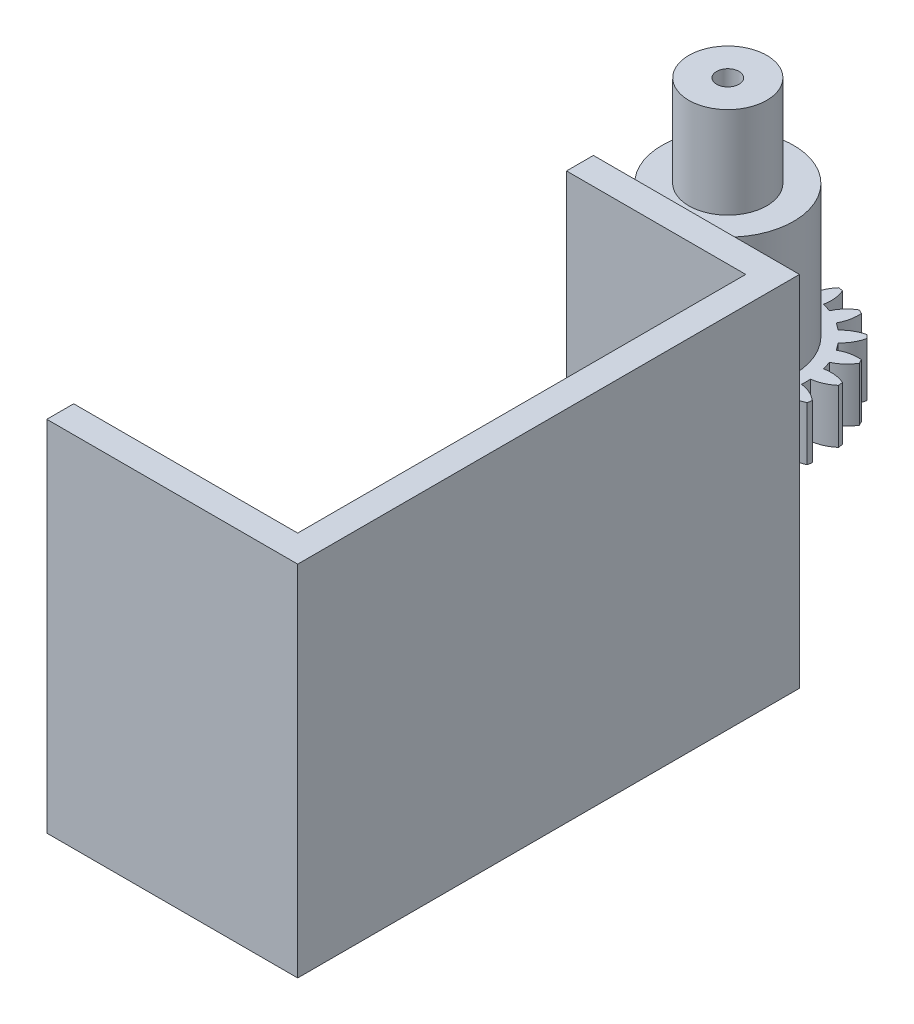
from build123d import *

# Parameters (mm, degrees)
EXTRUDE_1_DEPTH = 6
EXTRUDE_2_DEPTH = 20
SKETCH_3_W      = 25
SKETCH_3_H      = 50
EXTRUDE_3_DEPTH = 3
EXTRUDE_4_DEPTH = 6
SKETCH_5_R      = 7.35
EXTRUDE_5_DEPTH = 14.8
SKETCH_6_R      = 4.35
SKETCH_6_R_2    = 1.25
EXTRUDE_6_DEPTH = 10.2


with BuildPart() as part:
    # 草图1 → 凸台-拉伸1 (new body)
    with BuildSketch(Plane(origin=(0, 0, 0), x_dir=(1, 0, 0), z_dir=(0, 1, 0))):
        with BuildLine():
            Line((-5, 0), (-5, -13))
            Line((-5, -13), (15, -13))
            Line((15, -13), (15, -63))
            Line((15, -63), (-10, -63))
            Line((-10, -63), (-10, -66))
            Line((-10, -66), (18, -66))
            Line((18, -66), (18, -10))
            Line((18, -10), (5, -10))
            Line((5, -10), (5, 0))
            ThreePointArc((5, 0), (0, 5), (-5, 0))
        make_face()
    extrude(amount=-EXTRUDE_1_DEPTH)

    # 草图2 → 凸台-拉伸2 (add, symmetric)
    with BuildSketch(Plane(origin=(0, 0, 0), x_dir=(1, 0, 0), z_dir=(0, 1, 0))):
        Polygon((-5, -13), (15, -13), (15, -63), (-10, -63), (-10, -66), (18, -66), (18, -10), (-5, -10), align=None)
    extrude(amount=EXTRUDE_2_DEPTH, both=True)

    # 草图3 → 凸台-拉伸3 (add)
    with BuildSketch(Plane.XZ.offset(20)):
        with Locations((2.5, 38)):
            Rectangle(SKETCH_3_W, SKETCH_3_H)
    extrude(amount=-EXTRUDE_3_DEPTH)

    # 草图4 → 凸台-拉伸4 (add)
    with BuildSketch(Plane.XZ.offset(6)):
        with BuildLine():
            ThreePointArc((-0.504732798, 8.734428762), (-0.823506466, 9.891100464), (-1.470958285, 10.901205517))
            ThreePointArc((-1.470958285, 10.901205517), (-1.726760313, 10.86362273), (-1.981608382, 10.820038273))
            ThreePointArc((-1.981608382, 10.820038273), (-2.283953757, 9.65896405), (-2.228374617, 8.460457882))
            ThreePointArc((-2.228374617, 8.460457882), (-2.708170263, 8.319303747), (-3.17911634, 8.150964378))
            ThreePointArc((-3.17911634, 8.150964378), (-3.839719327, 9.152518056), (-4.767622226, 9.913111434))
            ThreePointArc((-4.767622226, 9.913111434), (-4.999290692, 9.798320906), (-5.228197271, 9.678117239))
            ThreePointArc((-5.228197271, 9.678117239), (-5.156953143, 8.480440175), (-4.733735466, 7.357767973))
            ThreePointArc((-4.733735466, 7.357767973), (-5.146429214, 7.075257405), (-5.542305825, 6.76962681))
            ThreePointArc((-5.542305825, 6.76962681), (-6.480073708, 7.518023412), (-7.597598086, 7.954652936))
            ThreePointArc((-7.597598086, 7.954652936), (-7.782455665, 7.773891163), (-7.963013783, 7.588834659))
            ThreePointArc((-7.963013783, 7.588834659), (-7.525154025, 6.471791729), (-6.775725305, 5.53484847))
            ThreePointArc((-6.775725305, 5.53484847), (-7.080919818, 5.138635571), (-7.3629758, 4.725631002))
            ThreePointArc((-7.3629758, 4.725631002), (-8.486113324, 5.147612255), (-9.683868109, 5.217537585))
            ThreePointArc((-9.683868109, 5.217537585), (-9.803819655, 4.988498789), (-9.918355025, 4.756704069))
            ThreePointArc((-9.918355025, 4.756704069), (-9.1567404, 3.829639217), (-8.154459943, 3.170139435))
            ThreePointArc((-8.154459943, 3.170139435), (-8.322280653, 2.699008286), (-8.462906403, 2.219057507))
            ThreePointArc((-8.462906403, 2.219057507), (-9.661473042, 2.273316945), (-10.82221365, 1.969693302))
            ThreePointArc((-10.82221365, 1.969693302), (-10.86551747, 1.714797397), (-10.902818572, 1.458954141))
            ThreePointArc((-10.902818572, 1.458954141), (-9.892001226, 0.812614936), (-8.734979226, 0.495115065))
            ThreePointArc((-8.734979226, 0.495115065), (-8.748998674, -0.004816736), (-8.734428762, -0.504732798))
            ThreePointArc((-8.734428762, -0.504732798), (-9.891100464, -0.823506466), (-10.901205517, -1.470958285))
            ThreePointArc((-10.901205517, -1.470958285), (-10.86362273, -1.726760313), (-10.820038273, -1.981608382))
            ThreePointArc((-10.820038273, -1.981608382), (-9.65896405, -2.283953757), (-8.460457882, -2.228374617))
            ThreePointArc((-8.460457882, -2.228374617), (-8.319303747, -2.708170263), (-8.150964378, -3.17911634))
            ThreePointArc((-8.150964378, -3.17911634), (-9.152518056, -3.839719327), (-9.913111434, -4.767622226))
            ThreePointArc((-9.913111434, -4.767622226), (-9.798320906, -4.999290692), (-9.678117239, -5.228197271))
            ThreePointArc((-9.678117239, -5.228197271), (-8.480440175, -5.156953143), (-7.357767973, -4.733735466))
            ThreePointArc((-7.357767973, -4.733735466), (-7.075257405, -5.146429214), (-6.76962681, -5.542305825))
            ThreePointArc((-6.76962681, -5.542305825), (-7.518023412, -6.480073708), (-7.954652936, -7.597598086))
            ThreePointArc((-7.954652936, -7.597598086), (-7.773891163, -7.782455665), (-7.588834659, -7.963013783))
            ThreePointArc((-7.588834659, -7.963013783), (-6.471791729, -7.525154025), (-5.53484847, -6.775725305))
            ThreePointArc((-5.53484847, -6.775725305), (-5.138635571, -7.080919818), (-4.725631002, -7.3629758))
            ThreePointArc((-4.725631002, -7.3629758), (-5.147612255, -8.486113324), (-5.217537585, -9.683868109))
            ThreePointArc((-5.217537585, -9.683868109), (-4.988498789, -9.803819655), (-4.756704069, -9.918355025))
            ThreePointArc((-4.756704069, -9.918355025), (-3.829639217, -9.1567404), (-3.170139435, -8.154459943))
            ThreePointArc((-3.170139435, -8.154459943), (-2.699008286, -8.322280653), (-2.219057507, -8.462906403))
            ThreePointArc((-2.219057507, -8.462906403), (-2.273316945, -9.661473042), (-1.969693302, -10.82221365))
            ThreePointArc((-1.969693302, -10.82221365), (-1.714797397, -10.86551747), (-1.458954141, -10.902818572))
            ThreePointArc((-1.458954141, -10.902818572), (-0.812614936, -9.892001226), (-0.495115065, -8.734979226))
            ThreePointArc((-0.495115065, -8.734979226), (0.004816736, -8.748998674), (0.504732798, -8.734428762))
            ThreePointArc((0.504732798, -8.734428762), (0.823506466, -9.891100464), (1.470958285, -10.901205517))
            ThreePointArc((1.470958285, -10.901205517), (1.726760313, -10.86362273), (1.981608382, -10.820038273))
            ThreePointArc((1.981608382, -10.820038273), (2.283953757, -9.65896405), (2.228374617, -8.460457882))
            ThreePointArc((2.228374617, -8.460457882), (2.708170263, -8.319303747), (3.17911634, -8.150964378))
            ThreePointArc((3.17911634, -8.150964378), (3.839719327, -9.152518056), (4.767622226, -9.913111434))
            ThreePointArc((4.767622226, -9.913111434), (4.999290692, -9.798320906), (5.228197271, -9.678117239))
            ThreePointArc((5.228197271, -9.678117239), (5.156953143, -8.480440175), (4.733735466, -7.357767973))
            ThreePointArc((4.733735466, -7.357767973), (5.146429214, -7.075257405), (5.542305825, -6.76962681))
            ThreePointArc((5.542305825, -6.76962681), (6.480073708, -7.518023412), (7.597598086, -7.954652936))
            ThreePointArc((7.597598086, -7.954652936), (7.782455665, -7.773891163), (7.963013783, -7.588834659))
            ThreePointArc((7.963013783, -7.588834659), (7.525154025, -6.471791729), (6.775725305, -5.53484847))
            ThreePointArc((6.775725305, -5.53484847), (7.080919818, -5.138635571), (7.3629758, -4.725631002))
            ThreePointArc((7.3629758, -4.725631002), (8.486113324, -5.147612255), (9.683868109, -5.217537585))
            ThreePointArc((9.683868109, -5.217537585), (9.803819655, -4.988498789), (9.918355025, -4.756704069))
            ThreePointArc((9.918355025, -4.756704069), (9.1567404, -3.829639217), (8.154459943, -3.170139435))
            ThreePointArc((8.154459943, -3.170139435), (8.322280653, -2.699008286), (8.462906403, -2.219057507))
            ThreePointArc((8.462906403, -2.219057507), (9.661473042, -2.273316945), (10.82221365, -1.969693302))
            ThreePointArc((10.82221365, -1.969693302), (10.86551747, -1.714797397), (10.902818572, -1.458954141))
            ThreePointArc((10.902818572, -1.458954141), (9.892001226, -0.812614936), (8.734979226, -0.495115065))
            ThreePointArc((8.734979226, -0.495115065), (8.748998674, 0.004816736), (8.734428762, 0.504732798))
            ThreePointArc((8.734428762, 0.504732798), (9.891100464, 0.823506466), (10.901205517, 1.470958285))
            ThreePointArc((10.901205517, 1.470958285), (10.86362273, 1.726760313), (10.820038273, 1.981608382))
            ThreePointArc((10.820038273, 1.981608382), (9.65896405, 2.283953757), (8.460457882, 2.228374617))
            ThreePointArc((8.460457882, 2.228374617), (8.319303747, 2.708170263), (8.150964378, 3.17911634))
            ThreePointArc((8.150964378, 3.17911634), (9.152518056, 3.839719327), (9.913111434, 4.767622226))
            ThreePointArc((9.913111434, 4.767622226), (9.798320906, 4.999290692), (9.678117239, 5.228197271))
            ThreePointArc((9.678117239, 5.228197271), (8.480440175, 5.156953143), (7.357767973, 4.733735466))
            ThreePointArc((7.357767973, 4.733735466), (7.075257405, 5.146429214), (6.76962681, 5.542305825))
            ThreePointArc((6.76962681, 5.542305825), (7.518023412, 6.480073708), (7.954652936, 7.597598086))
            ThreePointArc((7.954652936, 7.597598086), (7.773891163, 7.782455665), (7.588834659, 7.963013783))
            ThreePointArc((7.588834659, 7.963013783), (6.471791729, 7.525154025), (5.53484847, 6.775725305))
            ThreePointArc((5.53484847, 6.775725305), (5.138635571, 7.080919818), (4.725631002, 7.3629758))
            ThreePointArc((4.725631002, 7.3629758), (5.147612255, 8.486113324), (5.217537585, 9.683868109))
            ThreePointArc((5.217537585, 9.683868109), (4.988498789, 9.803819655), (4.756704069, 9.918355025))
            ThreePointArc((4.756704069, 9.918355025), (3.829639217, 9.1567404), (3.170139435, 8.154459943))
            ThreePointArc((3.170139435, 8.154459943), (2.699008286, 8.322280653), (2.219057507, 8.462906403))
            ThreePointArc((2.219057507, 8.462906403), (2.273316945, 9.661473042), (1.969693302, 10.82221365))
            ThreePointArc((1.969693302, 10.82221365), (1.714797397, 10.86551747), (1.458954141, 10.902818572))
            ThreePointArc((1.458954141, 10.902818572), (0.812614936, 9.892001226), (0.495115065, 8.734979226))
            ThreePointArc((0.495115065, 8.734979226), (-0.004816736, 8.748998674), (-0.504732798, 8.734428762))
        make_face()
    extrude(amount=-EXTRUDE_4_DEPTH)

    # 草图5 → 凸台-拉伸5 (add)
    with BuildSketch(Plane(origin=(0, 0, 0), x_dir=(1, 0, 0), z_dir=(0, 1, 0))):
        with Locations(Location((0, 0, 0), (0, 0, 270))):
            Circle(SKETCH_5_R)
    extrude(amount=EXTRUDE_5_DEPTH)

    # 草图6 → 凸台-拉伸6 (add)
    with BuildSketch(Plane(origin=(0, 14.8, 0), x_dir=(1, 0, 0), z_dir=(0, 1, 0))):
        with Locations(Location((0, 0, 0), (0, 0, 270))):
            Circle(SKETCH_6_R)
        with Locations(Location((0, 0, 0), (0, 0, 270))):
            Circle(SKETCH_6_R_2, mode=Mode.SUBTRACT)
    extrude(amount=EXTRUDE_6_DEPTH)


solid = part.part
